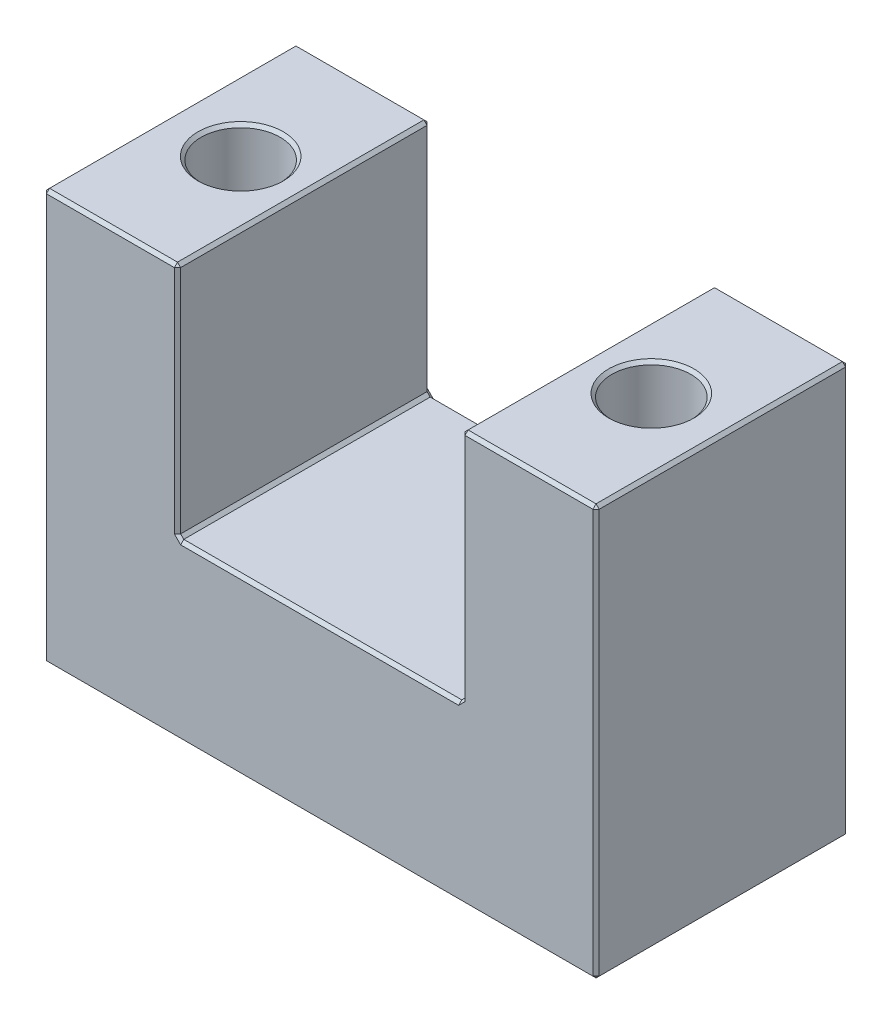
from build123d import *

# Parameters (mm, degrees)
BOSS_EXTRUDE1_DEPTH = 8
SKETCH2_R           = 2.5
CUT_EXTRUDE1_DEPTH  = 33.345787979
CHAMFER1_SIZE       = 0.2


with BuildPart() as part:
    # Sketch1 → Boss-Extrude1 (new, symmetric)
    with BuildSketch(Plane.XY):
        Polygon((0, 0), (-17.5, 0), (-17.5, 26), (-9, 26), (-9, 11), (0, 11), align=None)
    boss_extrude1 = extrude(amount=BOSS_EXTRUDE1_DEPTH, both=True)

    # Mirror1: Boss-Extrude1 across plane
    add(boss_extrude1.mirror(Plane(origin=(0, 0, 0), x_dir=(0, 0, 1), z_dir=(1, 0, 0))))

    # Sketch2 → Cut-Extrude1 (cut, through all)
    with BuildSketch(Plane(origin=(0, 26, 0), x_dir=(1, 0, 0), z_dir=(0, 1, 0))):
        with Locations(Location((-13, 0, 0), (0, 0, 270))):
            Circle(SKETCH2_R)
        with Locations(Location((13, 0, 0), (0, 0, 270))):
            Circle(SKETCH2_R)
    extrude(amount=-CUT_EXTRUDE1_DEPTH, mode=Mode.SUBTRACT)

    # Chamfer1
    chamfer1_edges = [part.edges().sort_by_distance(p)[0] for p in [
        (-17.5, 0, 0),
        (-17.5, 26, 0),
        (-9, 26, 0),
        (-9, 11, 0),
        (-9, 18.5, 8),
        (-13.25, 26, 8),
        (17.5, 13, 8),
        (-17.5, 13, 8),
        (17.5, 0, 0),
        (13.25, 26, 8),
        (17.5, 26, 0),
        (9, 18.5, 8),
        (9, 26, 0),
        (9, 11, 0),
        (9, 18.5, -8),
        (13.25, 26, -8),
        (17.5, 13, -8),
        (0, 0, 8),
        (-13, 0, -2.5),
        (-13, 26, -2.5),
        (13, 0, -2.5),
        (13, 26, -2.5),
        (0, 0, -8),
        (-17.5, 13, -8),
        (-13.25, 26, -8),
        (-9, 18.5, -8),
        (0, 11, -8),
        (0, 11, 8),
    ]]
    chamfer(chamfer1_edges, length=CHAMFER1_SIZE)


solid = part.part
